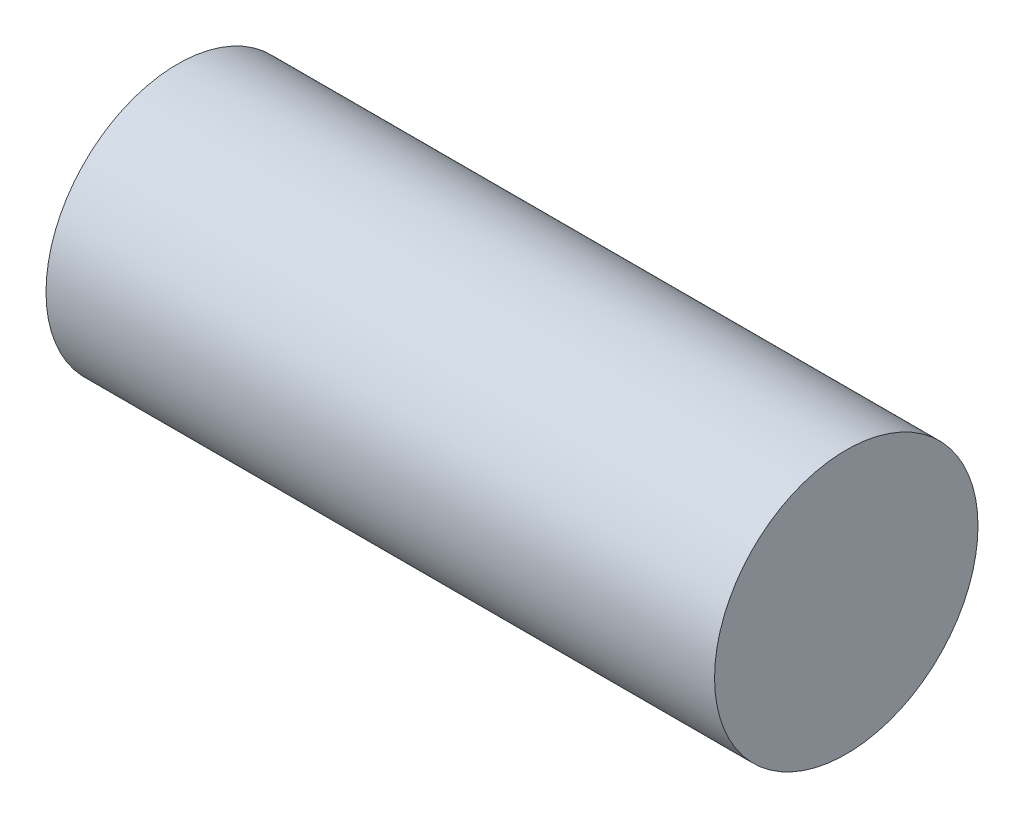
from build123d import *

# Parameters (mm, degrees)
SKETCH1_R           = 10.322814
BOSS_EXTRUDE1_DEPTH = 52.39512


with BuildPart() as part:
    # Sketch1 → Boss-Extrude1 (new body)
    with BuildSketch(Plane(origin=(0, 0, 0), x_dir=(0, 0, -1), z_dir=(1, 0, 0))):
        with Locations((364.15091, 35.14725)):
            Circle(SKETCH1_R)
    extrude(amount=-BOSS_EXTRUDE1_DEPTH)


solid = part.part
